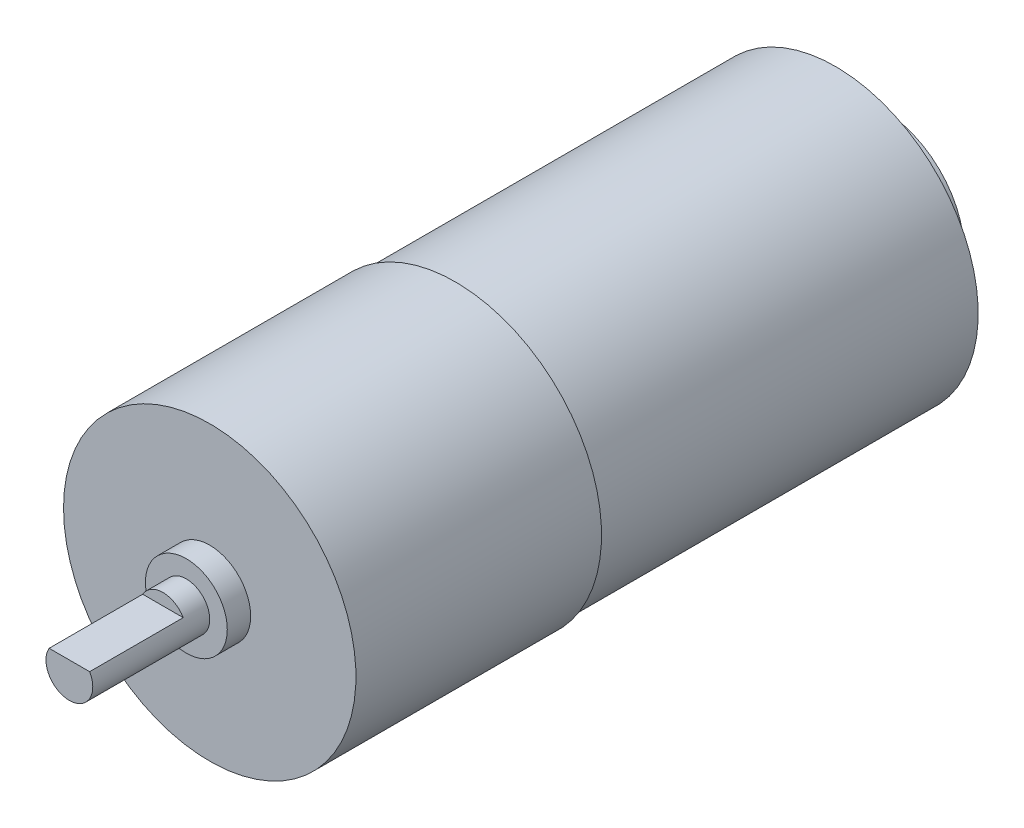
from build123d import *

# Parameters (mm, degrees)
ESBO_O1_R                 = 12.5
RESSALTO_EXTRUS_O2_DEPTH  = 21
ESBO_O2_R                 = 12.2
RESSALTO_EXTRUS_O3_DEPTH  = 31
ESBO_O3_R                 = 3.5
RESSALTO_EXTRUS_O4_DEPTH  = 2
ESBO_O4_R                 = 2
RESSALTO_EXTRUS_O6_DEPTH  = 10
CORTE_EXTRUS_O1_DEPTH     = 8
ESBO_O7_R                 = 12.2
RESSALTO_EXTRUS_O8_DEPTH  = 1.5
ESBO_O8_R                 = 0.75
RESSALTO_EXTRUS_O9_DEPTH  = 1
ESBO_O9_R                 = 7
RESSALTO_EXTRUS_O10_DEPTH = 3


with BuildPart() as part:
    # Esboço1 → Ressalto-extrusão2 (new body)
    with BuildSketch(Plane.XY):
        with Locations(Location((0, 0, 0), (0, 0, 180))):
            Circle(ESBO_O1_R)
    extrude(amount=RESSALTO_EXTRUS_O2_DEPTH)

    # Esboço2 → Ressalto-extrusão3 (add)
    with BuildSketch(Plane(origin=(0, 0, 0), x_dir=(-1, 0, 0), z_dir=(0, 0, -1))):
        Circle(ESBO_O2_R)
    extrude(amount=RESSALTO_EXTRUS_O3_DEPTH)

    # Esboço3 → Ressalto-extrusão4 (add)
    with BuildSketch(Plane.XY.offset(21)):
        Circle(ESBO_O3_R)
    extrude(amount=RESSALTO_EXTRUS_O4_DEPTH)

    # Esboço4 → Ressalto-extrusão6 (add)
    with BuildSketch(Plane.XY.offset(23)):
        Circle(ESBO_O4_R)
    extrude(amount=RESSALTO_EXTRUS_O6_DEPTH)

    # Esboço6 → Corte-extrusão1 (cut)
    with BuildSketch(Plane.XY.offset(33)):
        Polygon((0, 2), (3.689966046, 2), (3.689966046, 1), (-3.825112122, 1), (-3.825112122, 2), align=None)
    extrude(amount=-CORTE_EXTRUS_O1_DEPTH, mode=Mode.SUBTRACT)

    # Esboço7 → Ressalto-extrusão8 (add)
    with BuildSketch(Plane(origin=(0, 0, -31), x_dir=(-1, 0, 0), z_dir=(0, 0, -1))):
        Circle(ESBO_O7_R)
    extrude(amount=RESSALTO_EXTRUS_O8_DEPTH)

    # Esboço8 → Ressalto-extrusão9 (add)
    with BuildSketch(Plane(origin=(0, 0, -32.5), x_dir=(-1, 0, 0), z_dir=(0, 0, -1))):
        Circle(ESBO_O8_R)
    extrude(amount=RESSALTO_EXTRUS_O9_DEPTH)

    # Esboço9 → Ressalto-extrusão10 (add)
    with BuildSketch(Plane(origin=(0, 0, -33.5), x_dir=(-1, 0, 0), z_dir=(0, 0, -1))):
        Circle(ESBO_O9_R)
    extrude(amount=RESSALTO_EXTRUS_O10_DEPTH)


solid = part.part
